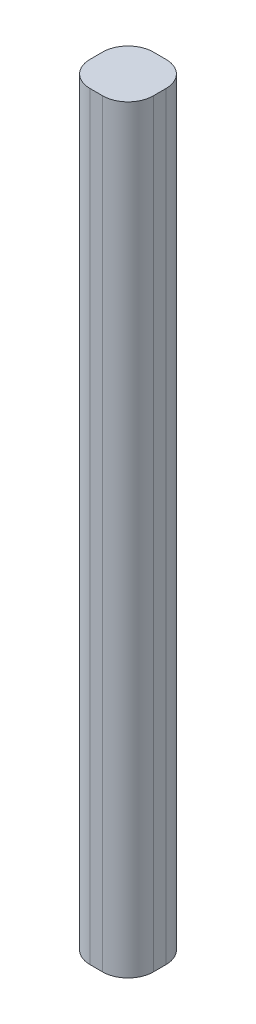
from build123d import *

# Parameters (mm, degrees)
SKETCH1_W           = 5
SKETCH1_H           = 5
BOSS_EXTRUDE1_DEPTH = 60
FILLET1_R           = 2


with BuildPart() as part:
    # Sketch1 → Boss-Extrude1 (new body)
    with BuildSketch(Plane(origin=(0, 0, 0), x_dir=(1, 0, 0), z_dir=(0, 1, 0))):
        Rectangle(SKETCH1_W, SKETCH1_H)
    extrude(amount=BOSS_EXTRUDE1_DEPTH)

    # Fillet1
    fillet1_edges = [part.edges().sort_by_distance(p)[0] for p in [
        (-2.5, 30, -2.5),
        (2.5, 30, -2.5),
        (2.5, 30, 2.5),
        (-2.5, 30, 2.5),
    ]]
    fillet(fillet1_edges, radius=FILLET1_R)


solid = part.part
